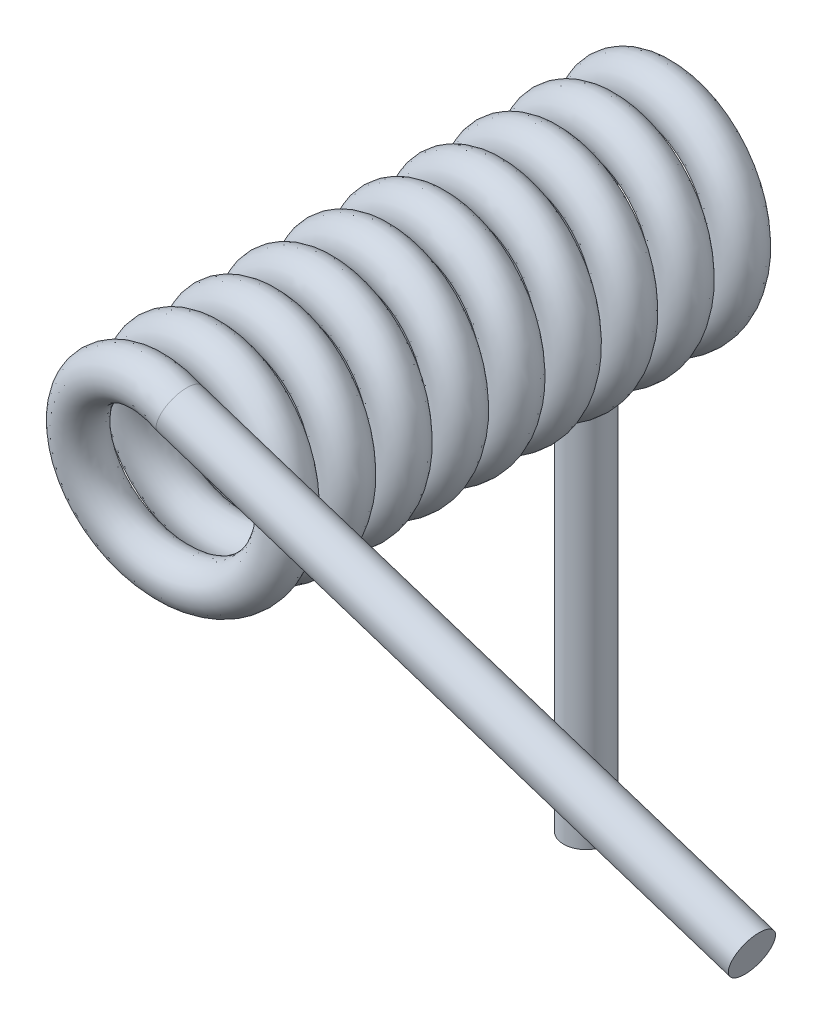
from build123d import *

# Parameters (mm, degrees)
SWEEP1_PITCH        = 3.75
SWEEP1_HEIGHT       = 34.875
SWEEP1_RADIUS       = 6
SWEEP1_START_ANGLE  = -180
SKETCH2_R           = 1.5
SKETCH3_R           = 1.5
BOSS_EXTRUDE1_DEPTH = 40
SKETCH7_R           = 1.5
BOSS_EXTRUDE3_DEPTH = 40


with BuildPart() as part:
    # Sweep1: sweep along a helix
    with BuildLine() as sweep1_path:
        add(Helix(SWEEP1_PITCH, SWEEP1_HEIGHT, SWEEP1_RADIUS, center=(0, 0, 0), direction=(0, 0, 1), lefthand=True, mode=Mode.PRIVATE).rotate(Axis((0, 0, 0), (0, 0, 1)), SWEEP1_START_ANGLE))
    # Sketch2 → Sweep1 (sweep)
    with BuildSketch(Plane(origin=(0, 0, 0), x_dir=(1, 0, 0), z_dir=(0, 1, 0))):
        with Locations((-6, 0)):
            Circle(SKETCH2_R)
    sweep(path=sweep1_path.line, is_frenet=True)

    # Sketch3 → Boss-Extrude1 (add)
    with BuildSketch(Plane.XZ):
        with Locations(Location((-6, 0, 0), (0, 0, 90))):
            Circle(SKETCH3_R)
    extrude(amount=BOSS_EXTRUDE1_DEPTH)

    # Sketch7 → Boss-Extrude3 (add)
    with BuildSketch(Plane(origin=(0, 0, 0), x_dir=(0.30901154807643844, 0.9510582858875701, 1.2621816828047145e-11), z_dir=(0.95105828588757, -0.3090115480764384, 0))):
        with Locations(Location((6, 34.875341955, 0), (0, 0, 89.999999999))):
            Circle(SKETCH7_R)
    extrude(amount=BOSS_EXTRUDE3_DEPTH)


solid = part.part
